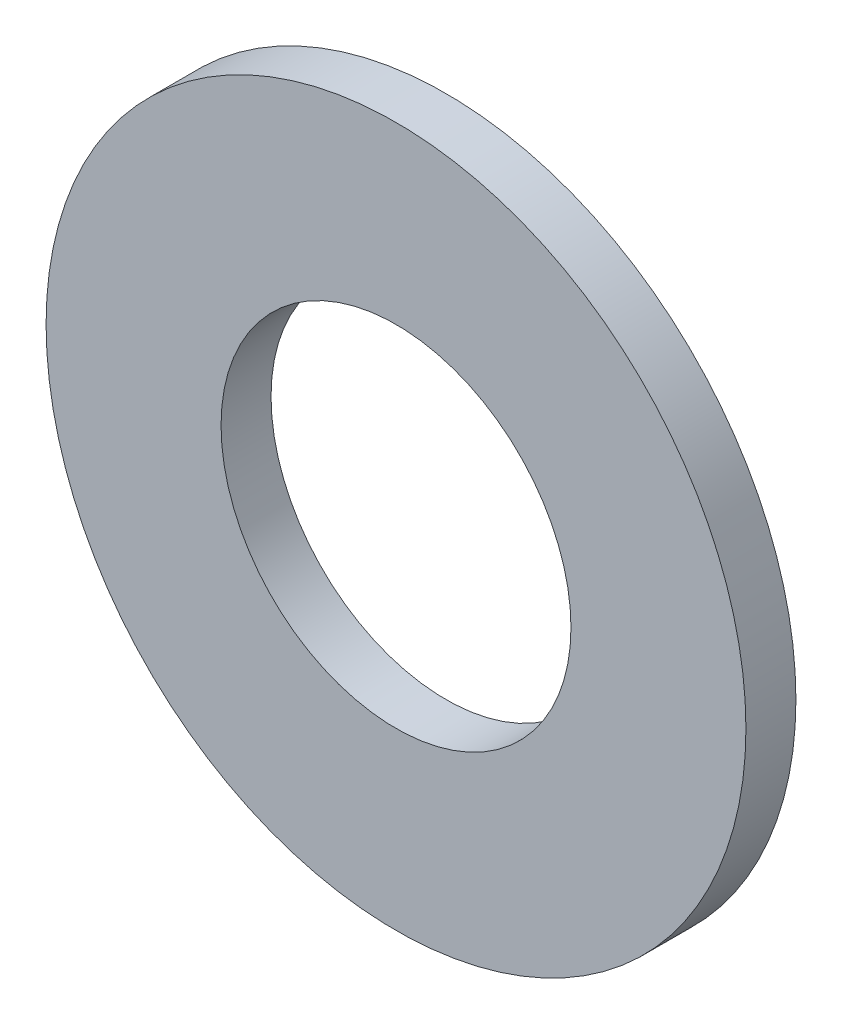
from build123d import *

# Parameters (mm, degrees)
SKETCH_1_R      = 3.5
SKETCH_1_R_2    = 1.75
EXTRUDE_1_DEPTH = 0.5


with BuildPart() as part:
    # 草图1 → 凸台-拉伸1 (new body)
    with BuildSketch(Plane.XY):
        Circle(SKETCH_1_R)
        Circle(SKETCH_1_R_2, mode=Mode.SUBTRACT)
    extrude(amount=EXTRUDE_1_DEPTH)


solid = part.part
